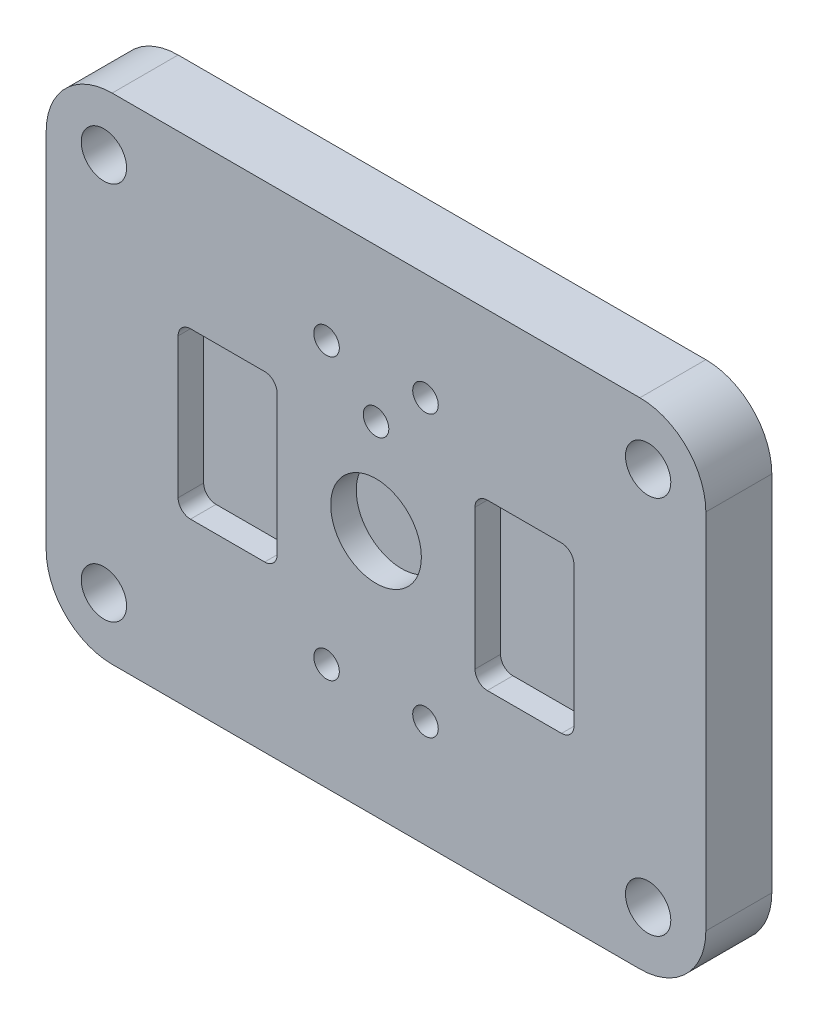
from build123d import *

# Parameters (mm, degrees)
SKETCH_1_W          = 80
SKETCH_1_H          = 60
SKETCH_1_W_2        = 47.3
SKETCH_1_H_2        = 47.3
EXTRUDE_1_DEPTH     = 8
SKETCH_2_R          = 5.5
SKETCH_2_R_2        = 1.55
SKETCH_2_W          = 12
SKETCH_2_H          = 20
CUT_EXTRUDE_1_DEPTH = 3.1
FILLET_1_R          = 1.5
SKETCH_3_R          = 1.55
CUT_EXTRUDE_2_DEPTH = 10
FILLET_2_R          = 8
SKETCH_4_R          = 3
CUT_EXTRUDE_3_DEPTH = 3.1
SKETCH_5_R          = 2.75
CUT_EXTRUDE_4_DEPTH = 10


with BuildPart() as part:
    # ｽｹｯﾁ1 → ﾎﾞｽ - 押し出し1 (new body)
    # profile 1 of 2: a face of its own
    with BuildSketch(Plane.XY):
        with Locations((23.65, 23.65)):
            Rectangle(SKETCH_1_W, SKETCH_1_H)
        with Locations((23.65, 23.65)):
            Rectangle(SKETCH_1_W_2, SKETCH_1_H_2, mode=Mode.SUBTRACT)
    # profile 2 of 2: a face of its own
    with BuildSketch(Plane.XY):
        with Locations((23.65, 23.65)):
            Rectangle(SKETCH_1_W_2, SKETCH_1_H_2)
    extrude(amount=EXTRUDE_1_DEPTH)

    # ｽｹｯﾁ2 → ｶｯﾄ - 押し出し1 (cut)
    with BuildSketch(Plane.XY.offset(8)):
        with Locations((23.65, 23.65)):
            Circle(SKETCH_2_R)
        with Locations((23.65, 35.15)):
            Circle(SKETCH_2_R_2)
        with Locations((5.65, 23.65)):
            Rectangle(SKETCH_2_W, SKETCH_2_H)
        with Locations((41.65, 23.65)):
            Rectangle(SKETCH_2_W, SKETCH_2_H)
    extrude(amount=-CUT_EXTRUDE_1_DEPTH, mode=Mode.SUBTRACT)

    # ﾌｨﾚｯﾄ1
    fillet_1_edges = [part.edges().sort_by_distance(p)[0] for p in [
        (11.65, 33.65, 6.45),
        (11.65, 13.65, 6.45),
        (-0.35, 13.65, 6.45),
        (-0.35, 33.65, 6.45),
        (47.65, 33.65, 6.45),
        (47.65, 13.65, 6.45),
        (35.65, 13.65, 6.45),
        (35.65, 33.65, 6.45),
    ]]
    fillet(fillet_1_edges, radius=FILLET_1_R)

    # ｽｹｯﾁ3 → ｶｯﾄ - 押し出し2 (cut)
    with BuildSketch(Plane.XY.offset(8)):
        with Locations((17.65, 40.65)):
            Circle(SKETCH_3_R)
        with Locations((29.65, 40.65)):
            Circle(SKETCH_3_R)
        with Locations((29.65, 6.65)):
            Circle(SKETCH_3_R)
        with Locations((17.65, 6.65)):
            Circle(SKETCH_3_R)
    extrude(amount=-CUT_EXTRUDE_2_DEPTH, mode=Mode.SUBTRACT)

    # ﾌｨﾚｯﾄ2
    fillet_2_edges = [part.edges().sort_by_distance(p)[0] for p in [
        (63.65, -6.35, 4),
        (-16.35, -6.35, 4),
        (-16.35, 53.65, 4),
        (63.65, 53.65, 4),
    ]]
    fillet(fillet_2_edges, radius=FILLET_2_R)

    # ｽｹｯﾁ4 → ｶｯﾄ - 押し出し3 (cut)
    with BuildSketch(Plane(origin=(0, 0, 0), x_dir=(-1, 0, 0), z_dir=(0, 0, -1))):
        with Locations((-29.65, 40.65)):
            Circle(SKETCH_4_R)
        with Locations((-17.65, 40.65)):
            Circle(SKETCH_4_R)
        with Locations((-17.65, 6.65)):
            Circle(SKETCH_4_R)
        with Locations((-29.65, 6.65)):
            Circle(SKETCH_4_R)
    extrude(amount=-CUT_EXTRUDE_3_DEPTH, mode=Mode.SUBTRACT)

    # ｽｹｯﾁ5 → ｶｯﾄ - 押し出し4 (cut)
    with BuildSketch(Plane.XY.offset(8)):
        with Locations((56.65, 0.65)):
            Circle(SKETCH_5_R)
        with Locations((56.65, 46.65)):
            Circle(SKETCH_5_R)
        with Locations((-9.35, 46.65)):
            Circle(SKETCH_5_R)
        with Locations((-9.35, 0.65)):
            Circle(SKETCH_5_R)
    extrude(amount=-CUT_EXTRUDE_4_DEPTH, mode=Mode.SUBTRACT)


solid = part.part
